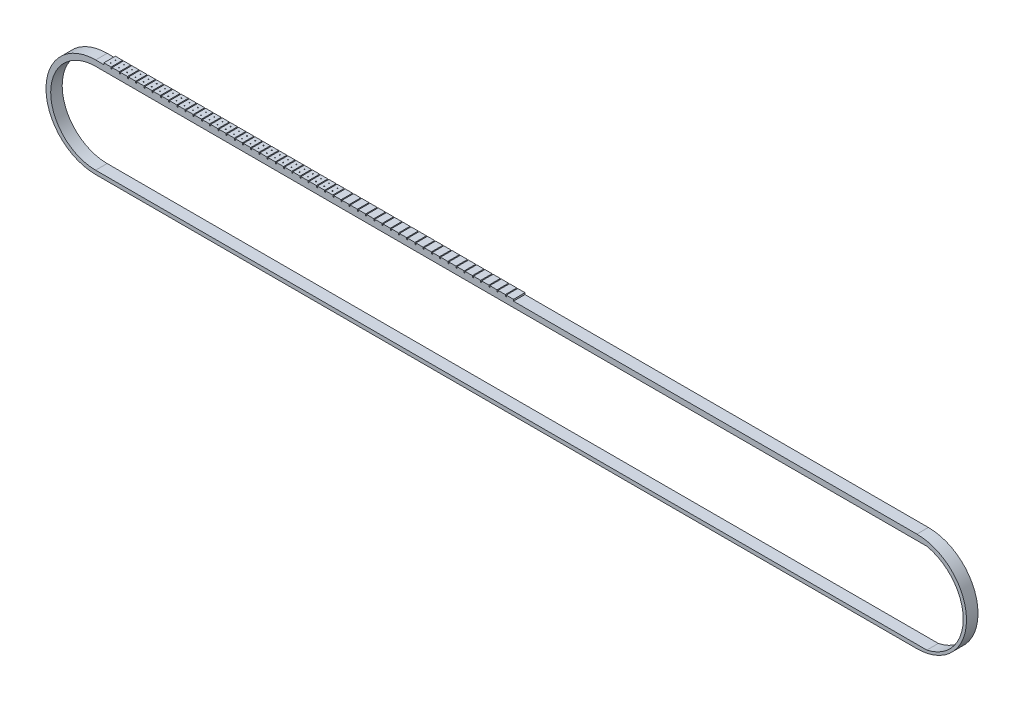
from build123d import *

# Parameters (mm, degrees)
BOSS_EXTRUDE1_DEPTH     = 70
CUT_EXTRUDE4_DEPTH      = 3153.531678006
CUT_EXTRUDE4_DEPTH_BACK = 3153.531678006
SKETCH4_W               = 44
SKETCH4_H               = 70
BOSS_EXTRUDE2_DEPTH     = 10
SKETCH5_W               = 44
SKETCH5_H               = 70
BOSS_EXTRUDE3_DEPTH     = 10
CUT_EXTRUDE5_DEPTH      = 3153.531678006
CUT_EXTRUDE5_DEPTH_BACK = 60
SKETCH6_R               = 2.5


with BuildPart() as part:
    # Sketch1 → Boss-Extrude1 (new body)
    with BuildSketch(Plane.XY):
        with BuildLine():
            Line((-2208.881027926, 0), (2791.118972074, 0))
            ThreePointArc((2791.118972074, 0), (3093.276475435, -302.157503362), (2791.118972074, -604.315006723))
            Line((2791.118972074, -604.315006723), (-2208.881027926, -604.315006723))
            ThreePointArc((-2208.881027926, -604.315006723), (-2511.038531288, -302.157503362), (-2208.881027926, 0))
        make_face()
    extrude(amount=BOSS_EXTRUDE1_DEPTH)

    # Sketch2 → Cut-Extrude4 (cut, two sides: drawn at the far end of the back side and taken through both)
    with BuildSketch(Plane.XY.offset(-CUT_EXTRUDE4_DEPTH_BACK)):
        with BuildLine():
            Line((2851.710416819, -33.921188796), (-2208.881027926, -33.921188796))
            ThreePointArc((-2208.881027926, -33.921188796), (-2482.501825267, -307.541986136), (-2208.881027926, -581.162783477))
            Line((-2208.881027926, -581.162783477), (2851.710416819, -581.162783477))
            ThreePointArc((2851.710416819, -581.162783477), (3073.447454812, -307.541986136), (2851.710416819, -33.921188796))
        make_face()
    extrude(amount=CUT_EXTRUDE4_DEPTH + CUT_EXTRUDE4_DEPTH_BACK, mode=Mode.SUBTRACT)

    # Sketch4 → Boss-Extrude2 (add)
    with BuildSketch(Plane(origin=(0, 0, 0), x_dir=(1, 0, 0), z_dir=(0, 1, 0))):
        with Locations((-2136.799095197, -35)):
            Rectangle(SKETCH4_W, SKETCH4_H)
    extrude(amount=BOSS_EXTRUDE2_DEPTH)

    # Sketch5 → Boss-Extrude3 (add)
    with BuildSketch(Plane(origin=(0, 0, 0), x_dir=(1, 0, 0), z_dir=(0, 1, 0))):
        with Locations((-2086.799095197, -35)):
            Rectangle(SKETCH5_W, SKETCH5_H)
        with Locations((-2136.799095197, -35)):
            Rectangle(SKETCH5_W, SKETCH5_H)
        with Locations((-2036.799095197, -35)):
            Rectangle(SKETCH5_W, SKETCH5_H)
        with Locations((-1986.799095197, -35)):
            Rectangle(SKETCH5_W, SKETCH5_H)
        with Locations((-1936.799095197, -35)):
            Rectangle(SKETCH5_W, SKETCH5_H)
        with Locations((-1886.799095197, -35)):
            Rectangle(SKETCH5_W, SKETCH5_H)
        with Locations((-1836.799095197, -35)):
            Rectangle(SKETCH5_W, SKETCH5_H)
        with Locations((-1786.799095197, -35)):
            Rectangle(SKETCH5_W, SKETCH5_H)
        with Locations((-1736.799095197, -35)):
            Rectangle(SKETCH5_W, SKETCH5_H)
        with Locations((-1686.799095197, -35)):
            Rectangle(SKETCH5_W, SKETCH5_H)
        with Locations((-1636.799095197, -35)):
            Rectangle(SKETCH5_W, SKETCH5_H)
        with Locations((-1586.799095197, -35)):
            Rectangle(SKETCH5_W, SKETCH5_H)
        with Locations((-1536.799095197, -35)):
            Rectangle(SKETCH5_W, SKETCH5_H)
        with Locations((-1486.799095197, -35)):
            Rectangle(SKETCH5_W, SKETCH5_H)
        with Locations((-1436.799095197, -35)):
            Rectangle(SKETCH5_W, SKETCH5_H)
        with Locations((-1386.799095197, -35)):
            Rectangle(SKETCH5_W, SKETCH5_H)
        with Locations((-1336.799095197, -35)):
            Rectangle(SKETCH5_W, SKETCH5_H)
        with Locations((-1286.799095197, -35)):
            Rectangle(SKETCH5_W, SKETCH5_H)
        with Locations((-1236.799095197, -35)):
            Rectangle(SKETCH5_W, SKETCH5_H)
        with Locations((-1186.799095197, -35)):
            Rectangle(SKETCH5_W, SKETCH5_H)
        with Locations((-1136.799095197, -35)):
            Rectangle(SKETCH5_W, SKETCH5_H)
        with Locations((-1086.799095197, -35)):
            Rectangle(SKETCH5_W, SKETCH5_H)
        with Locations((-1036.799095197, -35)):
            Rectangle(SKETCH5_W, SKETCH5_H)
        with Locations((-986.799095197, -35)):
            Rectangle(SKETCH5_W, SKETCH5_H)
        with Locations((-936.799095197, -35)):
            Rectangle(SKETCH5_W, SKETCH5_H)
        with Locations((-886.799095197, -35)):
            Rectangle(SKETCH5_W, SKETCH5_H)
        with Locations((-836.799095197, -35)):
            Rectangle(SKETCH5_W, SKETCH5_H)
        with Locations((-786.799095197, -35)):
            Rectangle(SKETCH5_W, SKETCH5_H)
        with Locations((-736.799095197, -35)):
            Rectangle(SKETCH5_W, SKETCH5_H)
        with Locations((-686.799095197, -35)):
            Rectangle(SKETCH5_W, SKETCH5_H)
        with Locations((-636.799095197, -35)):
            Rectangle(SKETCH5_W, SKETCH5_H)
        with Locations((-586.799095197, -35)):
            Rectangle(SKETCH5_W, SKETCH5_H)
        with Locations((-536.799095197, -35)):
            Rectangle(SKETCH5_W, SKETCH5_H)
        with Locations((-486.799095197, -35)):
            Rectangle(SKETCH5_W, SKETCH5_H)
        with Locations((-436.799095197, -35)):
            Rectangle(SKETCH5_W, SKETCH5_H)
        with Locations((-386.799095197, -35)):
            Rectangle(SKETCH5_W, SKETCH5_H)
        with Locations((-336.799095197, -35)):
            Rectangle(SKETCH5_W, SKETCH5_H)
        with Locations((-286.799095197, -35)):
            Rectangle(SKETCH5_W, SKETCH5_H)
        with Locations((-236.799095197, -35)):
            Rectangle(SKETCH5_W, SKETCH5_H)
        with Locations((-186.799095197, -35)):
            Rectangle(SKETCH5_W, SKETCH5_H)
        with Locations((-136.799095197, -35)):
            Rectangle(SKETCH5_W, SKETCH5_H)
        with Locations((-86.799095197, -35)):
            Rectangle(SKETCH5_W, SKETCH5_H)
        with Locations((-36.799095197, -35)):
            Rectangle(SKETCH5_W, SKETCH5_H)
        with Locations((13.200904803, -35)):
            Rectangle(SKETCH5_W, SKETCH5_H)
        with Locations((63.200904803, -35)):
            Rectangle(SKETCH5_W, SKETCH5_H)
        with Locations((113.200904803, -35)):
            Rectangle(SKETCH5_W, SKETCH5_H)
        with Locations((163.200904803, -35)):
            Rectangle(SKETCH5_W, SKETCH5_H)
        with Locations((213.200904803, -35)):
            Rectangle(SKETCH5_W, SKETCH5_H)
        with Locations((263.200904803, -35)):
            Rectangle(SKETCH5_W, SKETCH5_H)
        with Locations((313.200904803, -35)):
            Rectangle(SKETCH5_W, SKETCH5_H)
    extrude(amount=BOSS_EXTRUDE3_DEPTH)

    # Sketch6 → Cut-Extrude5 (cut, two sides: drawn at the far end of the back side and taken through both)
    with BuildSketch(Plane(origin=(0, 0, 0), x_dir=(1, 0, 0), z_dir=(0, 1, 0)).offset(-CUT_EXTRUDE5_DEPTH_BACK)):
        with Locations(Location((-2136.799095197, -20, 0), (0, 0, 270))):
            Circle(SKETCH6_R)
        with Locations(Location((-2136.799095197, -50, 0), (0, 0, 270))):
            Circle(SKETCH6_R)
        with Locations(Location((-2086.799095197, -20, 0), (0, 0, 270))):
            Circle(SKETCH6_R)
        with Locations(Location((-2086.799095197, -50, 0), (0, 0, 270))):
            Circle(SKETCH6_R)
        with Locations(Location((-2036.799095197, -20, 0), (0, 0, 270))):
            Circle(SKETCH6_R)
        with Locations(Location((-2036.799095197, -50, 0), (0, 0, 270))):
            Circle(SKETCH6_R)
        with Locations(Location((-1986.799095197, -20, 0), (0, 0, 270))):
            Circle(SKETCH6_R)
        with Locations(Location((-1986.799095197, -50, 0), (0, 0, 270))):
            Circle(SKETCH6_R)
        with Locations(Location((-1936.799095197, -20, 0), (0, 0, 270))):
            Circle(SKETCH6_R)
        with Locations(Location((-1936.799095197, -50, 0), (0, 0, 270))):
            Circle(SKETCH6_R)
        with Locations(Location((-1886.799095197, -20, 0), (0, 0, 270))):
            Circle(SKETCH6_R)
        with Locations(Location((-1886.799095197, -50, 0), (0, 0, 270))):
            Circle(SKETCH6_R)
        with Locations(Location((-1836.799095197, -20, 0), (0, 0, 270))):
            Circle(SKETCH6_R)
        with Locations(Location((-1836.799095197, -50, 0), (0, 0, 270))):
            Circle(SKETCH6_R)
        with Locations(Location((-1786.799095197, -20, 0), (0, 0, 270))):
            Circle(SKETCH6_R)
        with Locations(Location((-1786.799095197, -50, 0), (0, 0, 270))):
            Circle(SKETCH6_R)
        with Locations(Location((-1736.799095197, -20, 0), (0, 0, 270))):
            Circle(SKETCH6_R)
        with Locations(Location((-1736.799095197, -50, 0), (0, 0, 270))):
            Circle(SKETCH6_R)
        with Locations(Location((-1686.799095197, -20, 0), (0, 0, 270))):
            Circle(SKETCH6_R)
        with Locations(Location((-1686.799095197, -50, 0), (0, 0, 270))):
            Circle(SKETCH6_R)
        with Locations(Location((-1636.799095197, -20, 0), (0, 0, 270))):
            Circle(SKETCH6_R)
        with Locations(Location((-1636.799095197, -50, 0), (0, 0, 270))):
            Circle(SKETCH6_R)
        with Locations(Location((-1586.799095197, -20, 0), (0, 0, 270))):
            Circle(SKETCH6_R)
        with Locations(Location((-1586.799095197, -50, 0), (0, 0, 270))):
            Circle(SKETCH6_R)
        with Locations(Location((-1536.799095197, -20, 0), (0, 0, 270))):
            Circle(SKETCH6_R)
        with Locations(Location((-1536.799095197, -50, 0), (0, 0, 270))):
            Circle(SKETCH6_R)
        with Locations(Location((-1486.799095197, -20, 0), (0, 0, 270))):
            Circle(SKETCH6_R)
        with Locations(Location((-1486.799095197, -50, 0), (0, 0, 270))):
            Circle(SKETCH6_R)
        with Locations(Location((-1436.799095197, -20, 0), (0, 0, 270))):
            Circle(SKETCH6_R)
        with Locations(Location((-1436.799095197, -50, 0), (0, 0, 270))):
            Circle(SKETCH6_R)
        with Locations(Location((-1386.799095197, -20, 0), (0, 0, 270))):
            Circle(SKETCH6_R)
        with Locations(Location((-1386.799095197, -50, 0), (0, 0, 270))):
            Circle(SKETCH6_R)
        with Locations(Location((-1336.799095197, -20, 0), (0, 0, 270))):
            Circle(SKETCH6_R)
        with Locations(Location((-1336.799095197, -50, 0), (0, 0, 270))):
            Circle(SKETCH6_R)
        with Locations(Location((-1286.799095197, -20, 0), (0, 0, 270))):
            Circle(SKETCH6_R)
        with Locations(Location((-1286.799095197, -50, 0), (0, 0, 270))):
            Circle(SKETCH6_R)
        with Locations(Location((-1236.799095197, -20, 0), (0, 0, 270))):
            Circle(SKETCH6_R)
        with Locations(Location((-1236.799095197, -50, 0), (0, 0, 270))):
            Circle(SKETCH6_R)
        with Locations(Location((-1186.799095197, -20, 0), (0, 0, 270))):
            Circle(SKETCH6_R)
        with Locations(Location((-1186.799095197, -50, 0), (0, 0, 270))):
            Circle(SKETCH6_R)
        with Locations(Location((-1136.799095197, -20, 0), (0, 0, 270))):
            Circle(SKETCH6_R)
        with Locations(Location((-1136.799095197, -50, 0), (0, 0, 270))):
            Circle(SKETCH6_R)
        with Locations(Location((-1086.799095197, -20, 0), (0, 0, 270))):
            Circle(SKETCH6_R)
        with Locations(Location((-1086.799095197, -50, 0), (0, 0, 270))):
            Circle(SKETCH6_R)
        with Locations(Location((-1036.799095197, -20, 0), (0, 0, 270))):
            Circle(SKETCH6_R)
        with Locations(Location((-1036.799095197, -50, 0), (0, 0, 270))):
            Circle(SKETCH6_R)
        with Locations(Location((-986.799095197, -20, 0), (0, 0, 270))):
            Circle(SKETCH6_R)
        with Locations(Location((-986.799095197, -50, 0), (0, 0, 270))):
            Circle(SKETCH6_R)
        with Locations(Location((-936.799095197, -20, 0), (0, 0, 270))):
            Circle(SKETCH6_R)
        with Locations(Location((-936.799095197, -50, 0), (0, 0, 270))):
            Circle(SKETCH6_R)
        with Locations(Location((-886.799095197, -20, 0), (0, 0, 270))):
            Circle(SKETCH6_R)
        with Locations(Location((-886.799095197, -50, 0), (0, 0, 270))):
            Circle(SKETCH6_R)
        with Locations(Location((-836.799095197, -20, 0), (0, 0, 270))):
            Circle(SKETCH6_R)
        with Locations(Location((-836.799095197, -50, 0), (0, 0, 270))):
            Circle(SKETCH6_R)
        with Locations(Location((-786.799095197, -20, 0), (0, 0, 270))):
            Circle(SKETCH6_R)
        with Locations(Location((-786.799095197, -50, 0), (0, 0, 270))):
            Circle(SKETCH6_R)
    extrude(amount=CUT_EXTRUDE5_DEPTH + CUT_EXTRUDE5_DEPTH_BACK, mode=Mode.SUBTRACT)


solid = part.part
